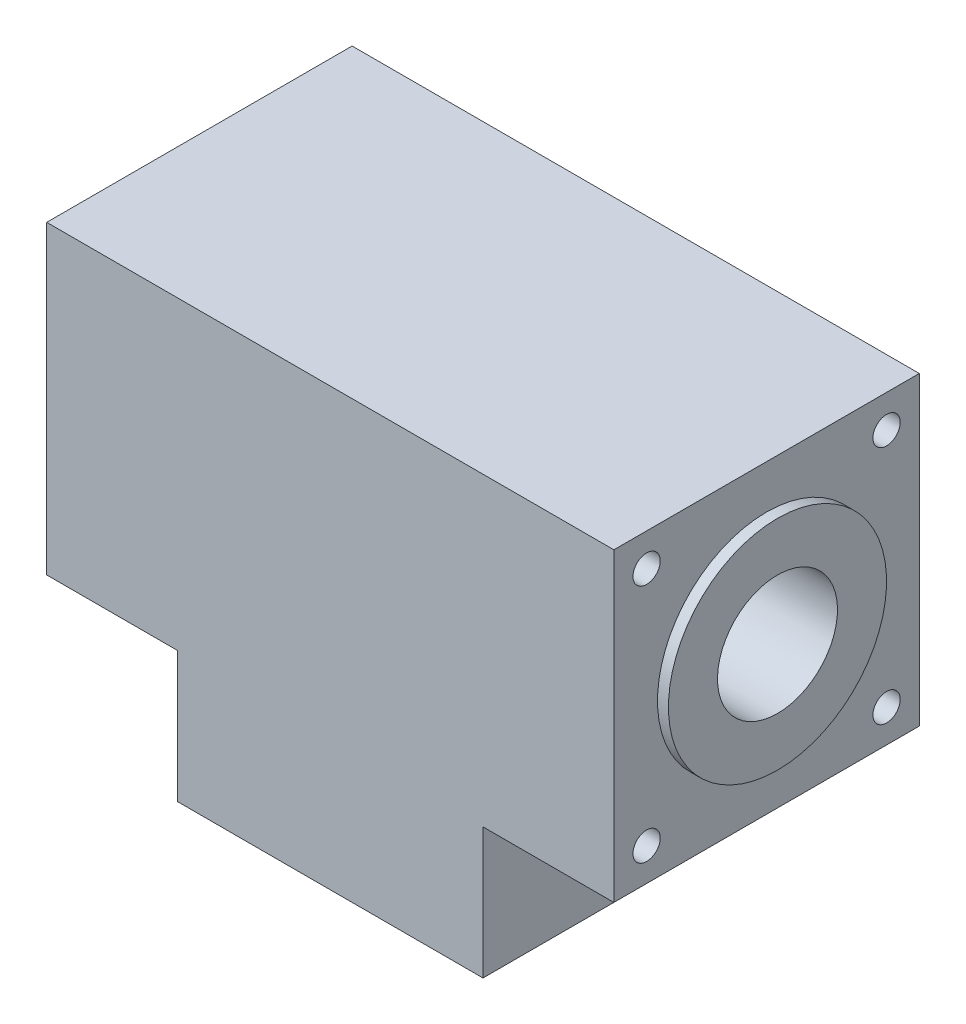
from build123d import *

# Parameters (mm, degrees)
BOSS_EXTRUDE1_DEPTH     = 56
SKETCH2_R               = 20
BOSS_EXTRUDE2_DEPTH     = 2
SKETCH4_R               = 20
BOSS_EXTRUDE3_DEPTH     = 2
SKETCH5_R               = 2.5
CUT_EXTRUDE1_DEPTH      = 11
SKETCH6_R               = 2.5
CUT_EXTRUDE2_DEPTH      = 11
CUT_EXTRUDE3_DEPTH      = 147.710599481
CUT_EXTRUDE3_DEPTH_BACK = 147.710599481
SKETCH7_R               = 11
SKETCH8_R               = 11
CUT_EXTRUDE4_DEPTH      = 51


with BuildPart() as part:
    # Sketch1 → Boss-Extrude1 (new body)
    with BuildSketch(Plane.XY):
        Polygon((-52, 0), (52, 0), (52, -56), (28, -56), (28, -80), (-28, -80), (-28, -56), (-52, -56), align=None)
    extrude(amount=BOSS_EXTRUDE1_DEPTH)

    # Sketch2 → Boss-Extrude2 (add)
    with BuildSketch(Plane(origin=(52, 0, 0), x_dir=(0, 0, -1), z_dir=(1, 0, 0))):
        with Locations(Location((-28, -28, 0), (0, 0, 90))):
            Circle(SKETCH2_R)
    boss_extrude2 = extrude(amount=BOSS_EXTRUDE2_DEPTH)

    # Mirror1: Boss-Extrude2 across plane
    add(boss_extrude2.mirror(Plane(origin=(0, 0, 0), x_dir=(0, 0, 1), z_dir=(1, 0, 0))))

    # Sketch4 → Boss-Extrude3 (add)
    with BuildSketch(Plane.XZ.offset(80)):
        with Locations(Location((0, 28, 0), (0, 0, 270))):
            Circle(SKETCH4_R)
    extrude(amount=BOSS_EXTRUDE3_DEPTH)

    # Sketch5 → Cut-Extrude1 (cut)
    with BuildSketch(Plane(origin=(52, 0, 0), x_dir=(0, 0, -1), z_dir=(1, 0, 0))):
        with Locations(Location((-50, -6, 0), (0, 0, 90))):
            Circle(SKETCH5_R)
        with Locations(Location((-50, -50, 0), (0, 0, 90))):
            Circle(SKETCH5_R)
        with Locations(Location((-6, -50, 0), (0, 0, 90))):
            Circle(SKETCH5_R)
        with Locations(Location((-6, -6, 0), (0, 0, 90))):
            Circle(SKETCH5_R)
    cut_extrude1 = extrude(amount=-CUT_EXTRUDE1_DEPTH, mode=Mode.SUBTRACT)

    # Mirror2: Cut-Extrude1 across plane
    add(cut_extrude1.mirror(Plane(origin=(0, 0, 0), x_dir=(0, 0, 1), z_dir=(1, 0, 0))), mode=Mode.SUBTRACT)

    # Sketch6 → Cut-Extrude2 (cut)
    with BuildSketch(Plane.XZ.offset(80)):
        with Locations(Location((-22, 50, 0), (0, 0, 270))):
            Circle(SKETCH6_R)
        with Locations(Location((22, 50, 0), (0, 0, 270))):
            Circle(SKETCH6_R)
        with Locations(Location((22, 6, 0), (0, 0, 270))):
            Circle(SKETCH6_R)
        with Locations(Location((-22, 6, 0), (0, 0, 270))):
            Circle(SKETCH6_R)
    extrude(amount=-CUT_EXTRUDE2_DEPTH, mode=Mode.SUBTRACT)

    # Sketch7 → Cut-Extrude3 (cut, two sides: drawn at the far end of the back side and taken through both)
    with BuildSketch(Plane.ZY.offset(54).offset(-CUT_EXTRUDE3_DEPTH_BACK)):
        with Locations(Location((28, -28, 0), (0, 0, 270))):
            Circle(SKETCH7_R)
    extrude(amount=CUT_EXTRUDE3_DEPTH + CUT_EXTRUDE3_DEPTH_BACK, mode=Mode.SUBTRACT)

    # Sketch8 → Cut-Extrude4 (cut)
    with BuildSketch(Plane.XZ.offset(82)):
        with Locations(Location((0, 28, 0), (0, 0, 270))):
            Circle(SKETCH8_R)
    extrude(amount=-CUT_EXTRUDE4_DEPTH, mode=Mode.SUBTRACT)


solid = part.part
